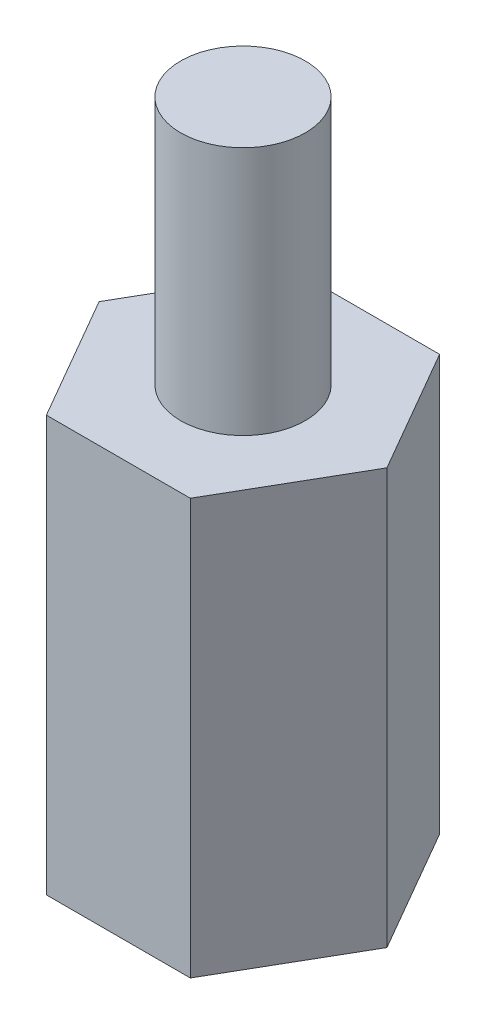
from build123d import *

# Parameters (mm, degrees)
BOSS_EXTRUDE1_DEPTH = 10
SKETCH2_R           = 1.5
BOSS_EXTRUDE2_DEPTH = 6
CUT_EXTRUDE1_START  = -10
SKETCH2_2_R         = 1.5
CUT_EXTRUDE1_DEPTH  = 6


with BuildPart() as part:
    # Sketch1 → Boss-Extrude1 (new body)
    with BuildSketch(Plane(origin=(0, 0, 0), x_dir=(1, 0, 0), z_dir=(0, 1, 0))):
        Polygon((1.732050808, -3), (3.464101615, 0), (1.732050808, 3), (-1.732050808, 3), (-3.464101615, 0), (-1.732050808, -3), align=None)
    extrude(amount=BOSS_EXTRUDE1_DEPTH)

    # Sketch2 → Boss-Extrude2 (add)
    with BuildSketch(Plane(origin=(0, 10, 0), x_dir=(1, 0, 0), z_dir=(0, 1, 0))):
        with Locations(Location((0, 0, 0), (0, 0, 270))):
            Circle(SKETCH2_R)
    extrude(amount=BOSS_EXTRUDE2_DEPTH)

    # Sketch2<2> → Cut-Extrude1 (cut)
    with BuildSketch(Plane(origin=(0, 10, 0), x_dir=(1, 0, 0), z_dir=(0, 1, 0)).offset(CUT_EXTRUDE1_START)):
        with Locations(Location((0, 0, 0), (0, 0, 270))):
            Circle(SKETCH2_2_R)
    extrude(amount=CUT_EXTRUDE1_DEPTH, mode=Mode.SUBTRACT)


solid = part.part
